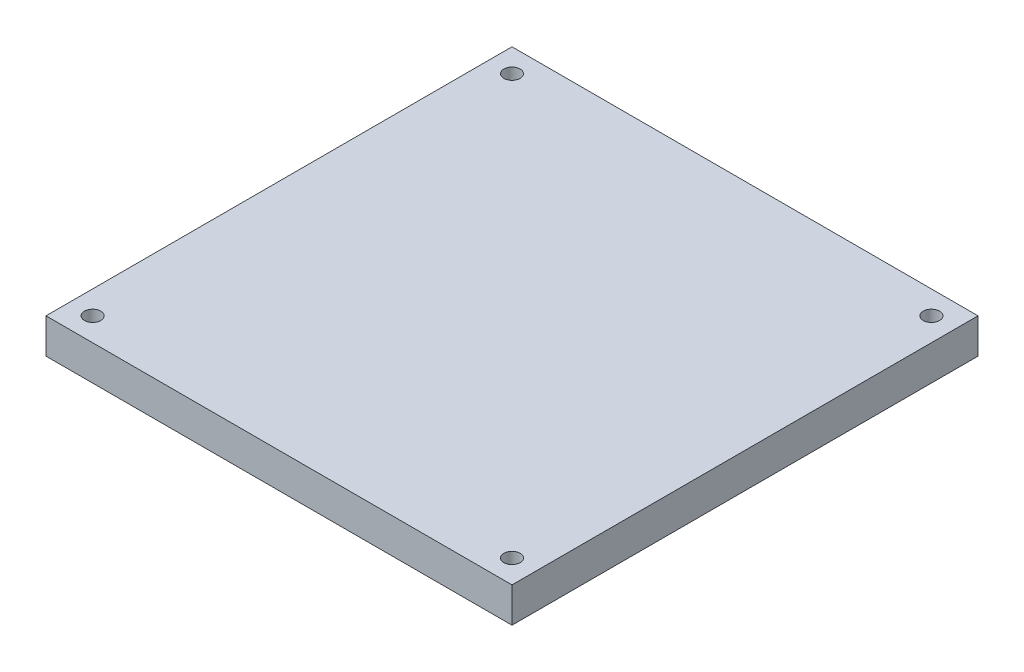
from build123d import *

# Parameters (mm, degrees)
SKETCH1_W             = 200
SKETCH1_H             = 200
BOSS_EXTRUDE1_DEPTH   = 15
M8X1_0_TAPPED_HOLE1_D = 7


with BuildPart() as part:
    # Sketch1 → Boss-Extrude1 (new body)
    with BuildSketch(Plane(origin=(0, 0, 0), x_dir=(1, 0, 0), z_dir=(0, 1, 0))):
        Rectangle(SKETCH1_W, SKETCH1_H)
    extrude(amount=BOSS_EXTRUDE1_DEPTH)

    # M8x1.0 Tapped Hole1 (through all)
    with Locations(Plane(origin=(0, 0, 0), x_dir=(-1, 0, 0), z_dir=(0, -1, 0))):
        with Locations((90, 90), (90, -90), (-90, -90), (-90, 90)):
            Hole(M8X1_0_TAPPED_HOLE1_D / 2)


solid = part.part
